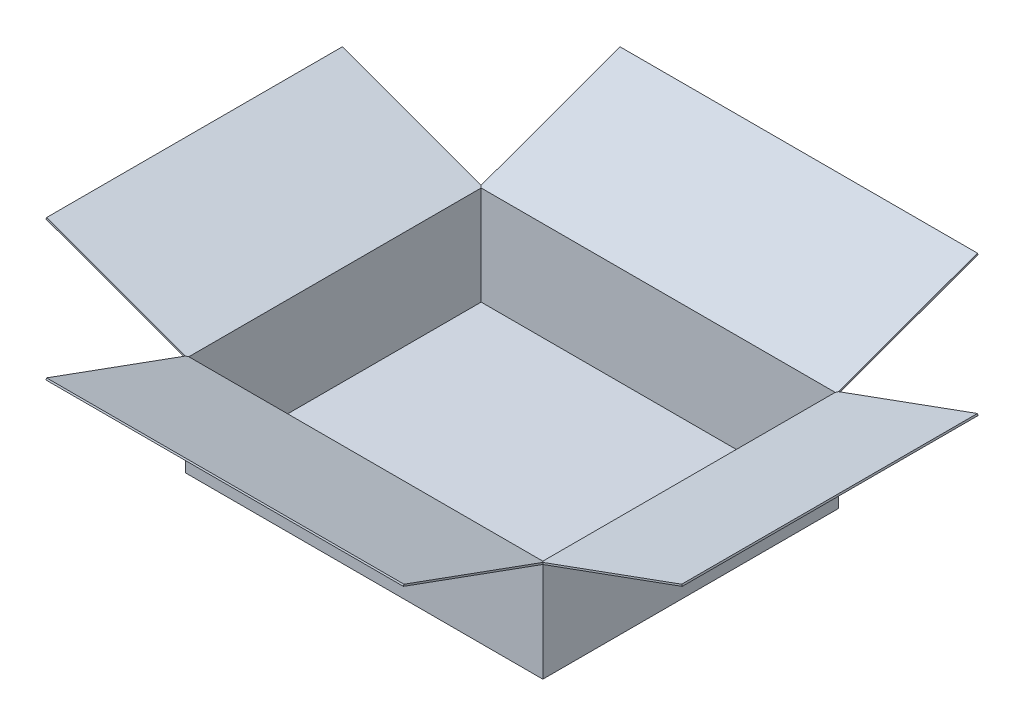
from build123d import *

# Parameters (mm, degrees)
SKETCH1_W           = 423
SKETCH1_H           = 350
BOSS_EXTRUDE1_DEPTH = 119
SHELL1_T            = -2
BOSS_EXTRUDE2_REACH = 474.985
BOSS_EXTRUDE3_REACH = 586.979


with BuildPart() as part:
    # Sketch1 → Boss-Extrude1 (new body)
    with BuildSketch(Plane(origin=(0, 0, 0), x_dir=(1, 0, 0), z_dir=(0, 1, 0))):
        Rectangle(SKETCH1_W, SKETCH1_H)
    extrude(amount=BOSS_EXTRUDE1_DEPTH)

    # Shell1
    shell1_openings = [part.faces().sort_by_distance(p)[0] for p in [
        (0, 119, 0),
    ]]
    offset(amount=SHELL1_T, openings=shell1_openings, kind=Kind.INTERSECTION)

    # Boss-Extrude2: up to this face of the body (flat: up to its plane)
    boss_extrude2_end = Plane(part.part.faces().sort_by_distance((-211.5, 59.5, 0))[0])
    # Sketch2 → Boss-Extrude2 (add, up to the picked face)
    with BuildSketch(Plane(origin=(211.5, 0, 0), x_dir=(0, 0, -1), z_dir=(1, 0, 0)), mode=Mode.PRIVATE) as boss_extrude2_sk1:
        Polygon((-173, 119), (-339.325593879, 179.537565369), (-340.009634166, 177.658180127), (-173.684040287, 117.120614758), align=None)
    boss_extrude2_tool1 = split(extrude(boss_extrude2_sk1.sketch, amount=-BOSS_EXTRUDE2_REACH, mode=Mode.PRIVATE), bisect_by=boss_extrude2_end, keep=Keep.BOTH, mode=Mode.PRIVATE)
    boss_extrude2 = boss_extrude2_tool1.solids().sort_by(Axis((211.5, 148.32909, 256.504817), (-1, 0, 0)))[0]
    add(boss_extrude2)

    # Boss-Extrude3: up to this face of the body (flat: up to its plane)
    boss_extrude3_end = Plane(part.part.faces().sort_by_distance((0, 58.799792462, 175))[0])
    # Sketch4 → Boss-Extrude3 (add, up to the picked face)
    with BuildSketch(Plane(origin=(0, 0, -175), x_dir=(-1, 0, 0), z_dir=(0, 0, -1)), mode=Mode.PRIVATE) as boss_extrude3_sk1:
        Polygon((-209.5, 119), (-375.825593879, 179.537565369), (-376.509634166, 177.658180127), (-210.184040287, 117.120614758), align=None)
    boss_extrude3_tool1 = split(extrude(boss_extrude3_sk1.sketch, amount=-BOSS_EXTRUDE3_REACH, mode=Mode.PRIVATE), bisect_by=boss_extrude3_end, keep=Keep.BOTH, mode=Mode.PRIVATE)
    boss_extrude3 = boss_extrude3_tool1.solids().sort_by(Axis((293.004817, 148.32909, -175), (0, 0, 1)))[0]
    add(boss_extrude3)

    # Mirror1: Boss-Extrude2 across plane
    add(boss_extrude2.mirror(Plane.XY))

    # Mirror2: Boss-Extrude3 across plane
    add(boss_extrude3.mirror(Plane(origin=(0, 0, 0), x_dir=(0, 0, 1), z_dir=(1, 0, 0))))


solid = part.part
